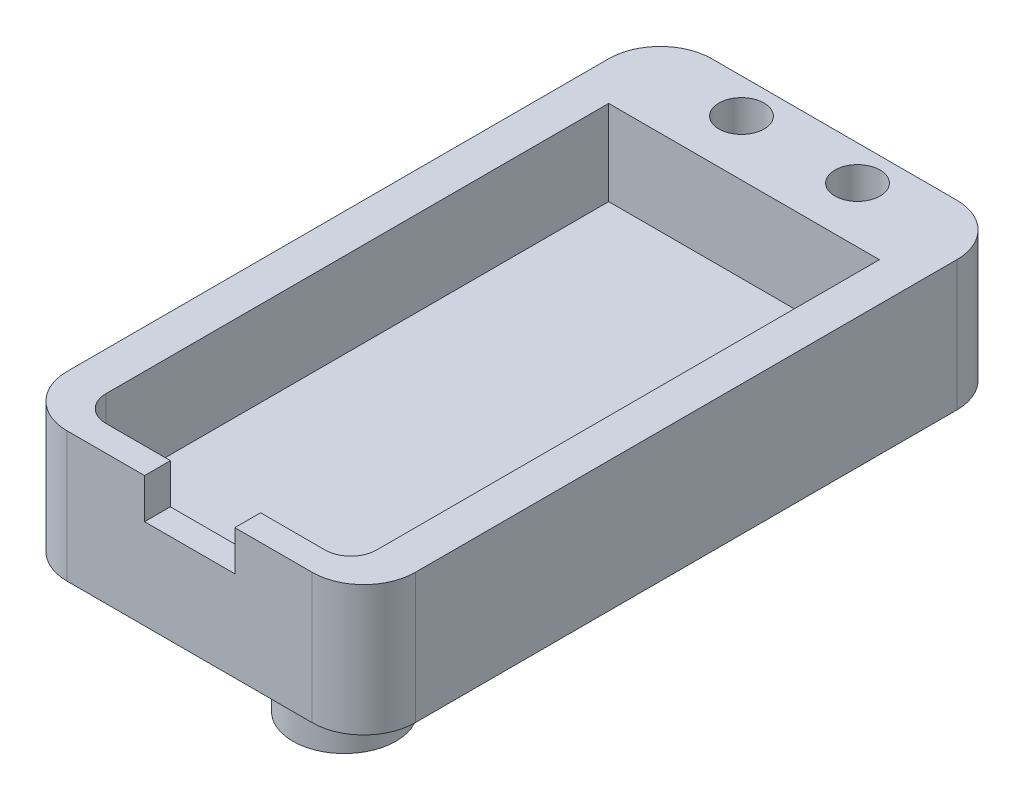
from build123d import *

# Parameters (mm, degrees)
SKETCH1_W           = 27
SKETCH1_H           = 41
BOSS_EXTRUDE1_DEPTH = 3.5
SKETCH2_W           = 3
SKETCH2_H           = 41
BOSS_EXTRUDE2_DEPTH = 7.5
SKETCH3_R           = 4
BOSS_EXTRUDE3_DEPTH = 10
SKETCH4_W           = 27
SKETCH4_H           = 11
BOSS_EXTRUDE4_DEPTH = 2
SKETCH5_W           = 27
SKETCH5_H           = 11
BOSS_EXTRUDE5_DEPTH = 2
CUT_EXTRUDE1_REACH  = 55.619
SKETCH6_W           = 7
SKETCH6_H           = 4
SKETCH7_W           = 27
SKETCH7_H           = 11
BOSS_EXTRUDE6_DEPTH = 5
SKETCH8_R           = 1.75
CUT_EXTRUDE2_DEPTH  = 59.940648113
SKETCH9_W           = 27
SKETCH9_H           = 50
CUT_EXTRUDE3_DEPTH  = 0.9
FILLET1_R           = 4
FILLET2_R           = 2


with BuildPart() as part:
    # Sketch1 → Boss-Extrude1 (new body)
    with BuildSketch(Plane(origin=(0, 0, 0), x_dir=(1, 0, 0), z_dir=(0, 1, 0))):
        with Locations((13.5, 20.5)):
            Rectangle(SKETCH1_W, SKETCH1_H)
    extrude(amount=BOSS_EXTRUDE1_DEPTH)

    # Sketch2 → Boss-Extrude2 (add)
    with BuildSketch(Plane(origin=(0, 3.5, 0), x_dir=(1, 0, 0), z_dir=(0, 1, 0))):
        with Locations((1.5, 20.5)):
            Rectangle(SKETCH2_W, SKETCH2_H)
        with Locations((25.5, 20.5)):
            Rectangle(SKETCH2_W, SKETCH2_H)
    extrude(amount=BOSS_EXTRUDE2_DEPTH)

    # Sketch3 → Boss-Extrude3 (add)
    with BuildSketch(Plane(origin=(0, 0, 0), x_dir=(-1, 0, 0), z_dir=(0, -1, 0))):
        with Locations(Location((-13.5, 10, 0), (0, 0, 270))):
            Circle(SKETCH3_R)
    extrude(amount=BOSS_EXTRUDE3_DEPTH)

    # Sketch4 → Boss-Extrude4 (add)
    with BuildSketch(Plane(origin=(0, 0, -41), x_dir=(-1, 0, 0), z_dir=(0, 0, -1))):
        with Locations((-13.5, 5.5)):
            Rectangle(SKETCH4_W, SKETCH4_H)
    extrude(amount=BOSS_EXTRUDE4_DEPTH)

    # Sketch5 → Boss-Extrude5 (add)
    with BuildSketch(Plane.XY):
        with Locations((13.5, 5.5)):
            Rectangle(SKETCH5_W, SKETCH5_H)
    extrude(amount=BOSS_EXTRUDE5_DEPTH)

    # Sketch6 → Cut-Extrude1 (cut, up to next)
    with BuildSketch(Plane.XY.offset(2), mode=Mode.PRIVATE) as cut_extrude1_sk1:
        with Locations((13.5, 9)):
            Rectangle(SKETCH6_W, SKETCH6_H)
    cut_extrude1_tool1 = extrude(cut_extrude1_sk1.sketch, amount=-CUT_EXTRUDE1_REACH, mode=Mode.PRIVATE) & part.part
    add(cut_extrude1_tool1.solids().sort_by_distance((13.5, 9, 2))[0], mode=Mode.SUBTRACT)

    # Sketch7 → Boss-Extrude6 (add)
    with BuildSketch(Plane(origin=(0, 0, -43), x_dir=(-1, 0, 0), z_dir=(0, 0, -1))):
        with Locations((-13.5, 5.5)):
            Rectangle(SKETCH7_W, SKETCH7_H)
    extrude(amount=BOSS_EXTRUDE6_DEPTH)

    # Sketch8 → Cut-Extrude2 (cut, through all)
    with BuildSketch(Plane(origin=(0, 11, 0), x_dir=(1, 0, 0), z_dir=(0, 1, 0))):
        with Locations(Location((18, 45.3, 0), (0, 0, 270))):
            Circle(SKETCH8_R)
        with Locations(Location((9, 45.3, 0), (0, 0, 270))):
            Circle(SKETCH8_R)
    extrude(amount=-CUT_EXTRUDE2_DEPTH, mode=Mode.SUBTRACT)

    # Sketch9 → Cut-Extrude3 (cut)
    with BuildSketch(Plane(origin=(0, 11, 0), x_dir=(1, 0, 0), z_dir=(0, 1, 0))):
        with Locations((13.5, 23)):
            Rectangle(SKETCH9_W, SKETCH9_H)
    extrude(amount=-CUT_EXTRUDE3_DEPTH, mode=Mode.SUBTRACT)

    # Fillet1
    fillet1_edges = [part.edges().sort_by_distance(p)[0] for p in [
        (27, 5.05, -48),
        (0, 5.05, 2),
        (27, 5.05, 2),
        (0, 5.05, -48),
    ]]
    fillet(fillet1_edges, radius=FILLET1_R)

    # Fillet2
    fillet2_edges = [part.edges().sort_by_distance(p)[0] for p in [
        (24, 6.8, 0),
        (3, 6.8, 0),
    ]]
    fillet(fillet2_edges, radius=FILLET2_R)


solid = part.part
